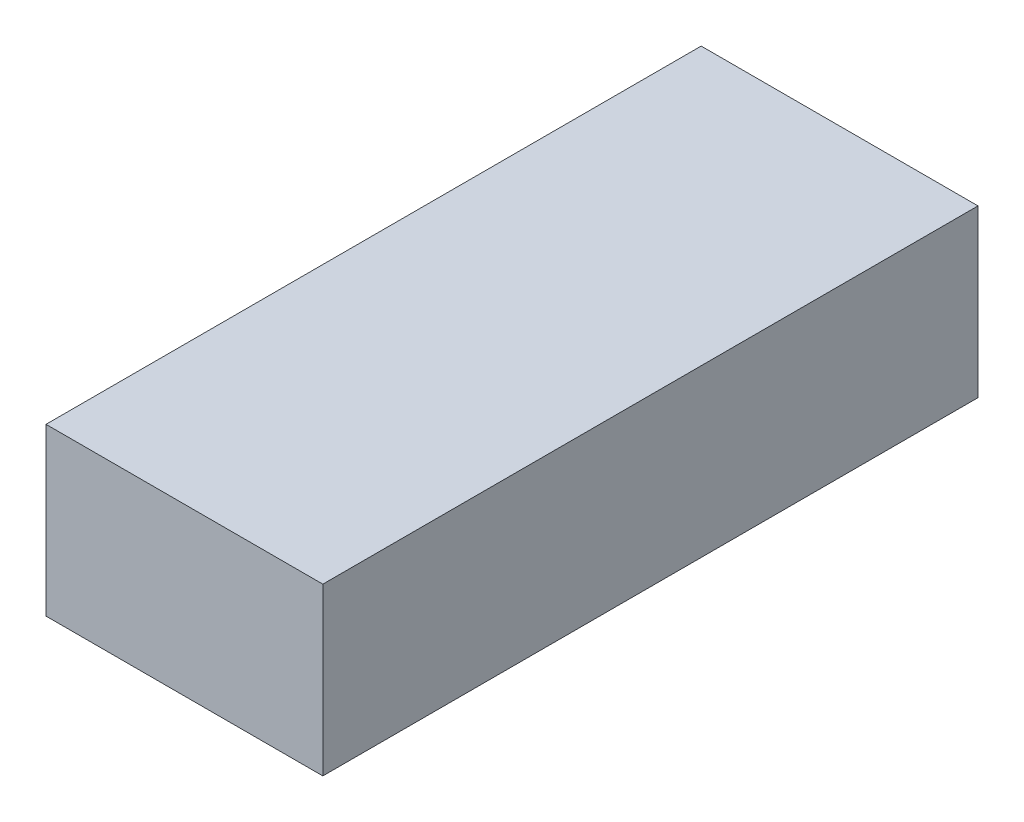
from build123d import *

# Parameters (mm, degrees)
SKETCH1_W           = 30
SKETCH1_H           = 71
BOSS_EXTRUDE1_DEPTH = 18


with BuildPart() as part:
    # Sketch1 → Boss-Extrude1 (new body)
    with BuildSketch(Plane(origin=(0, 0, 0), x_dir=(1, 0, 0), z_dir=(0, 1, 0))):
        Rectangle(SKETCH1_W, SKETCH1_H)
    extrude(amount=BOSS_EXTRUDE1_DEPTH)


solid = part.part
